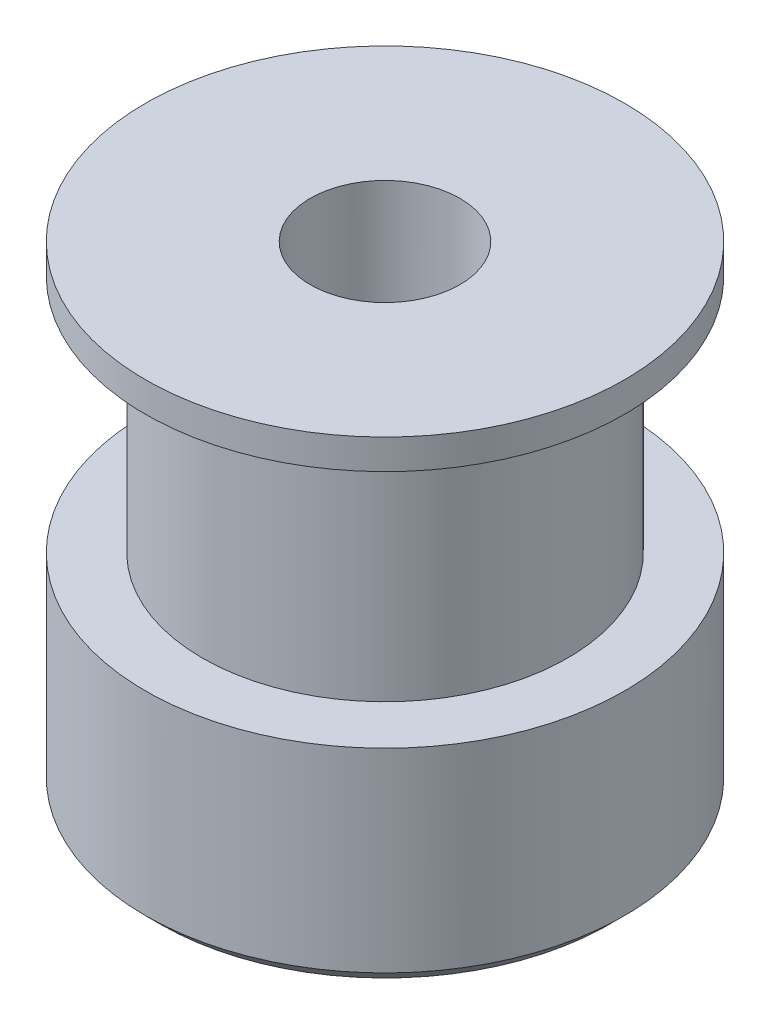
from build123d import *

# Parameters (mm, degrees)
CHAMFER1_SIZE           = 0.5
CUT_EXTRUDE1_REACH      = 21.596
CUT_EXTRUDE1_END_RADIUS = 8
SKETCH2_R               = 1.5
CUT_EXTRUDE2_REACH      = 21.596
CUT_EXTRUDE2_END_RADIUS = 8
SKETCH3_R               = 1.5


with BuildPart() as part:
    # Sketch1 → Revolve1 (revolve)
    with BuildSketch(Plane.XY, mode=Mode.PRIVATE) as revolve1_sk:
        Polygon((-2.5, 0), (-2.5, 16), (-8, 16), (-8, 15), (-6.1, 15), (-6.1, 7), (-8, 7), (-8, 0), align=None)
    revolve(revolve1_sk.sketch.rotate(Axis((0, 0, 0), (0, 1, 0)), 270), axis=Axis((0, 0, 0), (0, 1, 0)))

    # Chamfer1
    chamfer1_edges = [part.edges().sort_by_distance(p)[0] for p in [
        (0, 0, 8),
    ]]
    chamfer(chamfer1_edges, length=CHAMFER1_SIZE)

    # Cut-Extrude1: up to this cylinder (the profile starts inside it)
    cut_extrude1_end = Plane(origin=(0, 3.5, 0), z_dir=(0, -1, 0)) * Cylinder(CUT_EXTRUDE1_END_RADIUS, 60.192, mode=Mode.PRIVATE)
    # Sketch2 → Cut-Extrude1 (cut, up to the surface)
    with BuildSketch(Plane.XY, mode=Mode.PRIVATE) as cut_extrude1_sk1:
        with Locations((0, 3.5)):
            Circle(SKETCH2_R)
    cut_extrude1_tool1 = extrude(cut_extrude1_sk1.sketch, amount=-CUT_EXTRUDE1_REACH, mode=Mode.PRIVATE) & cut_extrude1_end
    add(cut_extrude1_tool1.solids().sort_by_distance((0, 3.5, 0))[0], mode=Mode.SUBTRACT)

    # Cut-Extrude2: up to this cylinder (the profile starts inside it)
    cut_extrude2_end = Plane(origin=(0, 3.5, 0), z_dir=(0, -1, 0)) * Cylinder(CUT_EXTRUDE2_END_RADIUS, 60.192, mode=Mode.PRIVATE)
    # Sketch3 → Cut-Extrude2 (cut, up to the surface)
    with BuildSketch(Plane(origin=(0, 0, 0), x_dir=(0, 0, -1), z_dir=(1, 0, 0)), mode=Mode.PRIVATE) as cut_extrude2_sk1:
        with Locations((0, 3.5)):
            Circle(SKETCH3_R)
    cut_extrude2_tool1 = extrude(cut_extrude2_sk1.sketch, amount=-CUT_EXTRUDE2_REACH, mode=Mode.PRIVATE) & cut_extrude2_end
    add(cut_extrude2_tool1.solids().sort_by_distance((0, 3.5, 0))[0], mode=Mode.SUBTRACT)


solid = part.part
